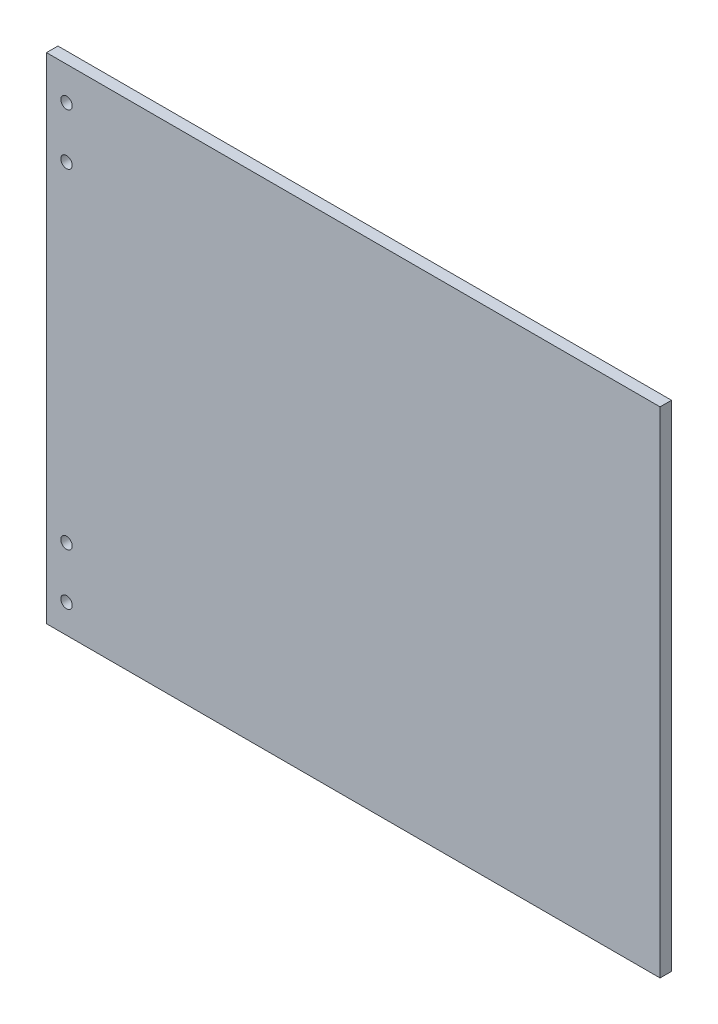
from build123d import *

# Parameters (mm, degrees)
ESQUISSE1_W             = 322
ESQUISSE1_H             = 259.581538462
BOSS_EXTRU_1_DEPTH      = 6
ENL_V_MAT_EXTRU_1_REACH = 407.288
ESQUISSE2_R             = 3


with BuildPart() as part:
    # Esquisse1 → Boss.-Extru.1 (new body)
    with BuildSketch(Plane.XY):
        with Locations((155.055384615, 123.846153846)):
            Rectangle(ESQUISSE1_W, ESQUISSE1_H)
    extrude(amount=BOSS_EXTRU_1_DEPTH)

    # Esquisse2 → Enlèv. mat.-Extru.1 (cut, up to next)
    with BuildSketch(Plane(origin=(0, 0, 0), x_dir=(-1, 0, 0), z_dir=(0, 0, -1)), mode=Mode.PRIVATE) as enl_v_mat_extru_1_sk1:
        with Locations((-4.555384615, 236.136923077)):
            Circle(ESQUISSE2_R)
    enl_v_mat_extru_1_tool1 = extrude(enl_v_mat_extru_1_sk1.sketch, amount=-ENL_V_MAT_EXTRU_1_REACH, mode=Mode.PRIVATE) & part.part
    # Esquisse2 → Enlèv. mat.-Extru.1 (cut, up to next)
    with BuildSketch(Plane(origin=(0, 0, 0), x_dir=(-1, 0, 0), z_dir=(0, 0, -1)), mode=Mode.PRIVATE) as enl_v_mat_extru_1_sk2:
        with Locations((-4.555384615, 209.136923077)):
            Circle(ESQUISSE2_R)
    enl_v_mat_extru_1_tool2 = extrude(enl_v_mat_extru_1_sk2.sketch, amount=-ENL_V_MAT_EXTRU_1_REACH, mode=Mode.PRIVATE) & part.part
    # Esquisse2 → Enlèv. mat.-Extru.1 (cut, up to next)
    with BuildSketch(Plane(origin=(0, 0, 0), x_dir=(-1, 0, 0), z_dir=(0, 0, -1)), mode=Mode.PRIVATE) as enl_v_mat_extru_1_sk3:
        with Locations((-4.555384615, 36.136923077)):
            Circle(ESQUISSE2_R)
    enl_v_mat_extru_1_tool3 = extrude(enl_v_mat_extru_1_sk3.sketch, amount=-ENL_V_MAT_EXTRU_1_REACH, mode=Mode.PRIVATE) & part.part
    # Esquisse2 → Enlèv. mat.-Extru.1 (cut, up to next)
    with BuildSketch(Plane(origin=(0, 0, 0), x_dir=(-1, 0, 0), z_dir=(0, 0, -1)), mode=Mode.PRIVATE) as enl_v_mat_extru_1_sk4:
        with Locations((-4.555384615, 9.136923077)):
            Circle(ESQUISSE2_R)
    enl_v_mat_extru_1_tool4 = extrude(enl_v_mat_extru_1_sk4.sketch, amount=-ENL_V_MAT_EXTRU_1_REACH, mode=Mode.PRIVATE) & part.part
    add(enl_v_mat_extru_1_tool1.solids().sort_by_distance((4.555385, 236.136923, 0))[0], mode=Mode.SUBTRACT)
    add(enl_v_mat_extru_1_tool2.solids().sort_by_distance((4.555385, 209.136923, 0))[0], mode=Mode.SUBTRACT)
    add(enl_v_mat_extru_1_tool3.solids().sort_by_distance((4.555385, 36.136923, 0))[0], mode=Mode.SUBTRACT)
    add(enl_v_mat_extru_1_tool4.solids().sort_by_distance((4.555385, 9.136923, 0))[0], mode=Mode.SUBTRACT)


solid = part.part
